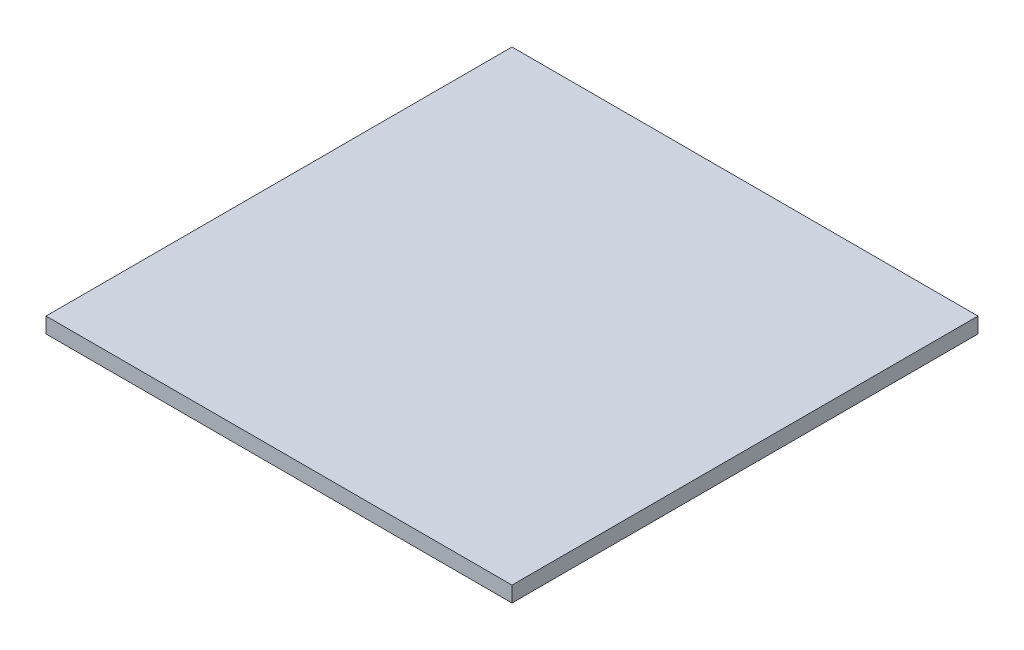
from build123d import *

# Parameters (mm, degrees)
SKETCH_1_W      = 60
SKETCH_1_H      = 60
EXTRUDE_1_DEPTH = 2


with BuildPart() as part:
    # Эскиз1 → Бобышка-Вытянуть1 (new body)
    with BuildSketch(Plane(origin=(0, 0, 0), x_dir=(1, 0, 0), z_dir=(0, 1, 0))):
        Rectangle(SKETCH_1_W, SKETCH_1_H)
    extrude(amount=EXTRUDE_1_DEPTH)


solid = part.part
